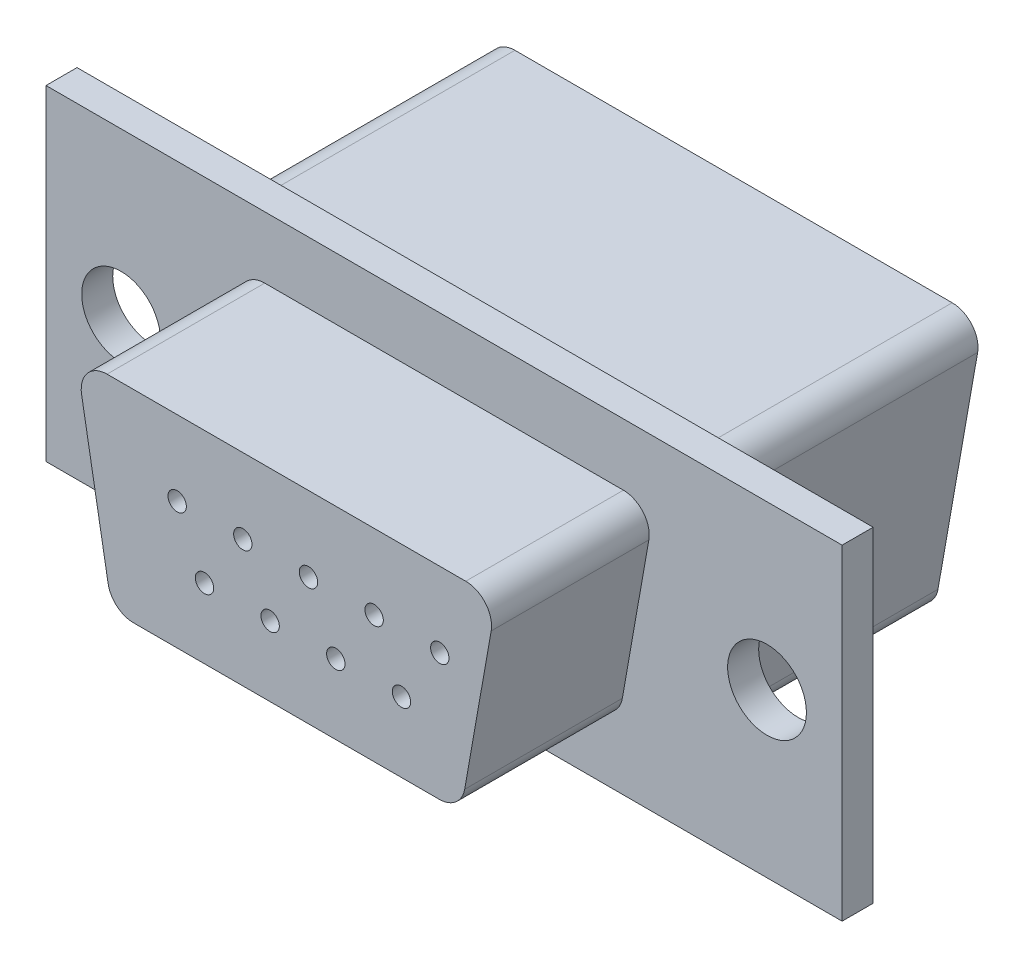
from build123d import *

# Parameters (mm, degrees)
SKETCH_1_W             = 30.8
SKETCH_1_H             = 12.6
EXTRUDE_1_DEPTH        = 1.2
EXTRUDE_2_DEPTH        = 6.1
EXTRUDE_3_DEPTH        = 10
SKETCH_5_W             = 0.3556
SKETCH_5_H             = 6.1
SKETCH_6_W             = 0.3556
SKETCH_6_H             = 6.1
PATTERN_LINEAR_1_COUNT = 5
PATTERN_LINEAR_1_PITCH = 2.54
PATTERN_LINEAR_2_COUNT = 4
PATTERN_LINEAR_2_PITCH = 2.54
HOLE_WIZARD_3_2_D      = 3.048
FILLET_1_R             = 1


with BuildPart() as part:
    # ｽｹｯﾁ1 → ﾎﾞｽ - 押し出し1 (new body)
    with BuildSketch(Plane.XY):
        Rectangle(SKETCH_1_W, SKETCH_1_H)
    extrude(amount=EXTRUDE_1_DEPTH)

    # ｽｹｯﾁ2 → ﾎﾞｽ - 押し出し2 (add)
    with BuildSketch(Plane.XY.offset(1.2)):
        Polygon((-6.751123011, -3.91), (6.751123011, -3.91), (8.13, 3.91), (-8.13, 3.91), align=None)
    extrude(amount=EXTRUDE_2_DEPTH)

    # ｽｹｯﾁ3 → ﾎﾞｽ - 押し出し3 (add)
    with BuildSketch(Plane(origin=(0, 0, 0), x_dir=(-1, 0, 0), z_dir=(0, 0, -1))):
        Polygon((-7.763301306, -5.35), (7.763301306, -5.35), (9.65, 5.35), (-9.65, 5.35), align=None)
    extrude(amount=EXTRUDE_3_DEPTH)

    # ｽｹｯﾁ5 → #0000 すきま穴1 (revolve, cut)
    with BuildSketch(Plane(origin=(-4.225439316, 1.008007938, 1.2), x_dir=(0, 1, 0), z_dir=(1, 0, 0))):
        with Locations((0.1778, 3.05)):
            Rectangle(SKETCH_5_W, SKETCH_5_H)
    hole_wizard_0000_1 = revolve(axis=Axis((-4.225439316, 1.008007938, -5.15), (0, 0, 1)), mode=Mode.SUBTRACT)

    # ｽｹｯﾁ6 → #0000 すきま穴2 (revolve, cut)
    with BuildSketch(Plane(origin=(-3.168321124, -1.202810505, 1.2), x_dir=(0, 1, 0), z_dir=(1, 0, 0))):
        with Locations((0.1778, 3.05)):
            Rectangle(SKETCH_6_W, SKETCH_6_H)
    hole_wizard_0000_2 = revolve(axis=Axis((-3.168321124, -1.202810505, -5.15), (0, 0, 1)), mode=Mode.SUBTRACT)

    # 直線ﾊﾟﾀｰﾝ1: #0000 すきま穴1 ×5
    with Locations(*[(i * PATTERN_LINEAR_1_PITCH, 0, 0) for i in range(1, PATTERN_LINEAR_1_COUNT)]):
        add(hole_wizard_0000_1, mode=Mode.SUBTRACT)

    # 直線ﾊﾟﾀｰﾝ2: #0000 すきま穴2 ×4
    with Locations(*[(i * PATTERN_LINEAR_2_PITCH, 0, 0) for i in range(1, PATTERN_LINEAR_2_COUNT)]):
        add(hole_wizard_0000_2, mode=Mode.SUBTRACT)

    # #3 すきま穴2 (through all)
    with Locations(Plane(origin=(-12.495, 0, 1.2), x_dir=(1, 0, 0), z_dir=(0, 0, 1))):
        with Locations((0, 0), (24.99, 0)):
            Hole(HOLE_WIZARD_3_2_D / 2)

    # ﾌｨﾚｯﾄ1
    fillet_1_edges = [part.edges().sort_by_distance(p)[0] for p in [
        (6.751123011, -3.91, 4.25),
        (8.13, 3.91, 4.25),
        (-8.13, 3.91, 4.25),
        (-6.751123011, -3.91, 4.25),
        (-7.763301306, -5.35, -5),
        (-9.65, 5.35, -5),
        (9.65, 5.35, -5),
        (7.763301306, -5.35, -5),
    ]]
    fillet(fillet_1_edges, radius=FILLET_1_R)


solid = part.part
